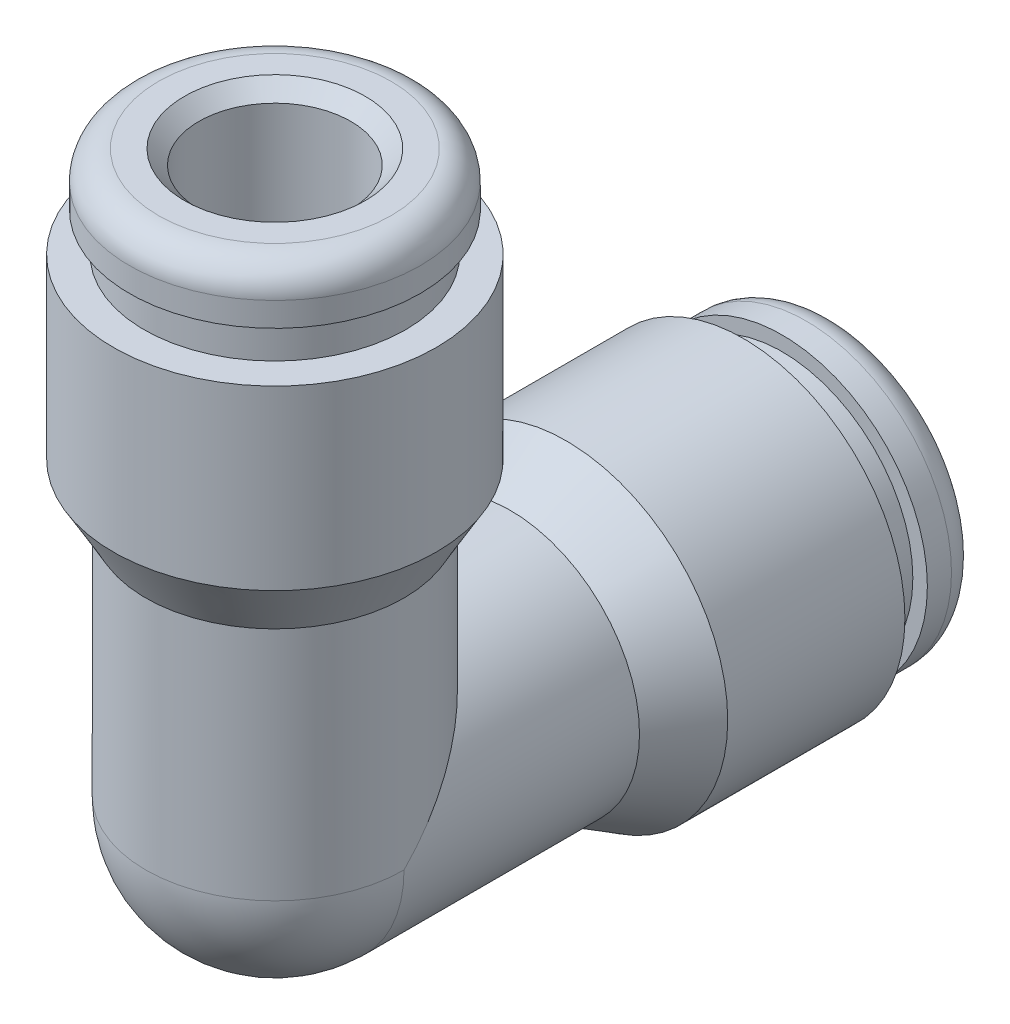
from build123d import *

# Parameters (mm, degrees)
CIRPATTERN1_COUNT = 2
CIRPATTERN1_ANGLE = 90
REVOLVE2_ANGLE    = 90
CIRPATTERN2_COUNT = 2
CIRPATTERN2_ANGLE = 90


with BuildPart() as part:
    # Sketch1 → Revolve1 (revolve)
    with BuildSketch(Plane(origin=(0, 0, 0), x_dir=(0, 0, -1), z_dir=(1, 0, 0)), mode=Mode.PRIVATE) as revolve1_sk:
        with BuildLine():
            Line((13.353, 3.825), (13.988, 3.825))
            ThreePointArc((13.988, 3.825), (14.526815367, 3.601815367), (14.75, 3.063))
            Line((14.75, 3.063), (14.75, 2.381))
            Line((14.75, 2.381), (14.369, 2))
            Line((14.369, 2), (5.25, 2))
            Line((5.25, 2), (5.25, 1.238))
            Line((5.25, 1.238), (0, 1.238))
            Line((0, 1.238), (0, 3.4))
            Line((0, 3.4), (6.2, 3.4))
            Line((6.2, 3.4), (7.672243186, 4.25))
            Line((7.672243186, 4.25), (12.337, 4.25))
            Line((12.337, 4.25), (12.337, 3.4425))
            Line((12.337, 3.4425), (13.353, 3.4425))
            Line((13.353, 3.4425), (13.353, 3.825))
        make_face()
    revolve(revolve1_sk.sketch.rotate(Axis((0, 0, 0), (0, 0, -1)), 90), axis=Axis((0, 0, 0), (0, 0, -1)))


with BuildPart() as cirpattern1_1:
    # CirPattern1: pattern copy
    add(part.part.rotate(Axis((-4.675, 0, 0), (1, 0, 0)), 1 * CIRPATTERN1_ANGLE / (CIRPATTERN1_COUNT - 1)))


with BuildPart() as part_1:
    add(part.part)

    # Sketch2 → Revolve2 (revolve)
    with BuildSketch(Plane.XY):
        with BuildLine():
            Line((-3.4, 0), (-1.238, 0))
            ThreePointArc((-1.238, 0), (0, -1.238), (1.238, 0))
            Line((1.238, 0), (3.4, 0))
            ThreePointArc((3.4, 0), (0, -3.4), (-3.4, 0))
        make_face()
    revolve(axis=Axis((-3.4, 0, 0), (-1, 0, 0)), revolution_arc=REVOLVE2_ANGLE)

    # Combine1: union CirPattern1_1
    add(cirpattern1_1.part)

    # Sketch3 → Cut-Revolve1 (revolve, cut)
    with BuildSketch(Plane(origin=(0, 0, 0), x_dir=(0, 0, -1), z_dir=(1, 0, 0)), mode=Mode.PRIVATE) as cut_revolve1_sk:
        Polygon((14.75, 2.381), (14.369, 2), (5.25, 2), (5.25, 1.238), (0, 1.238), (0, 0), (14.75, 0), align=None)
    cut_revolve1 = revolve(cut_revolve1_sk.sketch.rotate(Axis((0, 0, 0), (0, 0, -1)), 90), axis=Axis((0, 0, 0), (0, 0, -1)), mode=Mode.SUBTRACT)

    # CirPattern2: Cut-Revolve1 ×2 about axis
    cirpattern2_axis = Axis((-4.675, 0, 0), (1, 0, 0))
    for i in range(1, CIRPATTERN2_COUNT):
        add(cut_revolve1.rotate(cirpattern2_axis, i * CIRPATTERN2_ANGLE / (CIRPATTERN2_COUNT - 1)), mode=Mode.SUBTRACT)


solid = part_1.part
